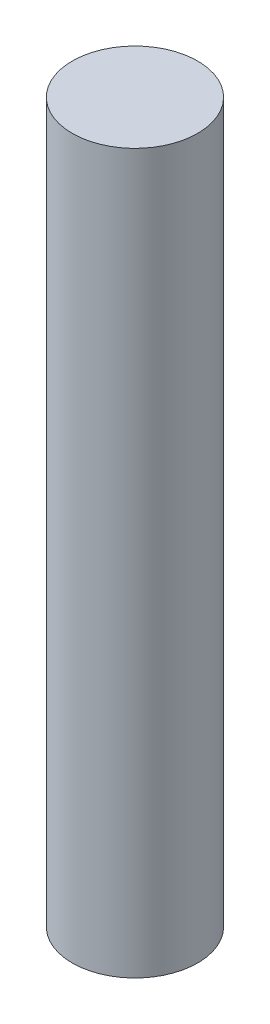
from build123d import *

# Parameters (mm, degrees)
SKETCH1_R           = 0.815
BOSS_EXTRUDE1_DEPTH = 9.34


with BuildPart() as part:
    # Sketch1 → Boss-Extrude1 (new body)
    with BuildSketch(Plane(origin=(0, 0, 0), x_dir=(1, 0, 0), z_dir=(0, 1, 0))):
        with Locations(Location((0, 0, 0), (0, 0, 270))):
            Circle(SKETCH1_R)
    extrude(amount=BOSS_EXTRUDE1_DEPTH)


solid = part.part
